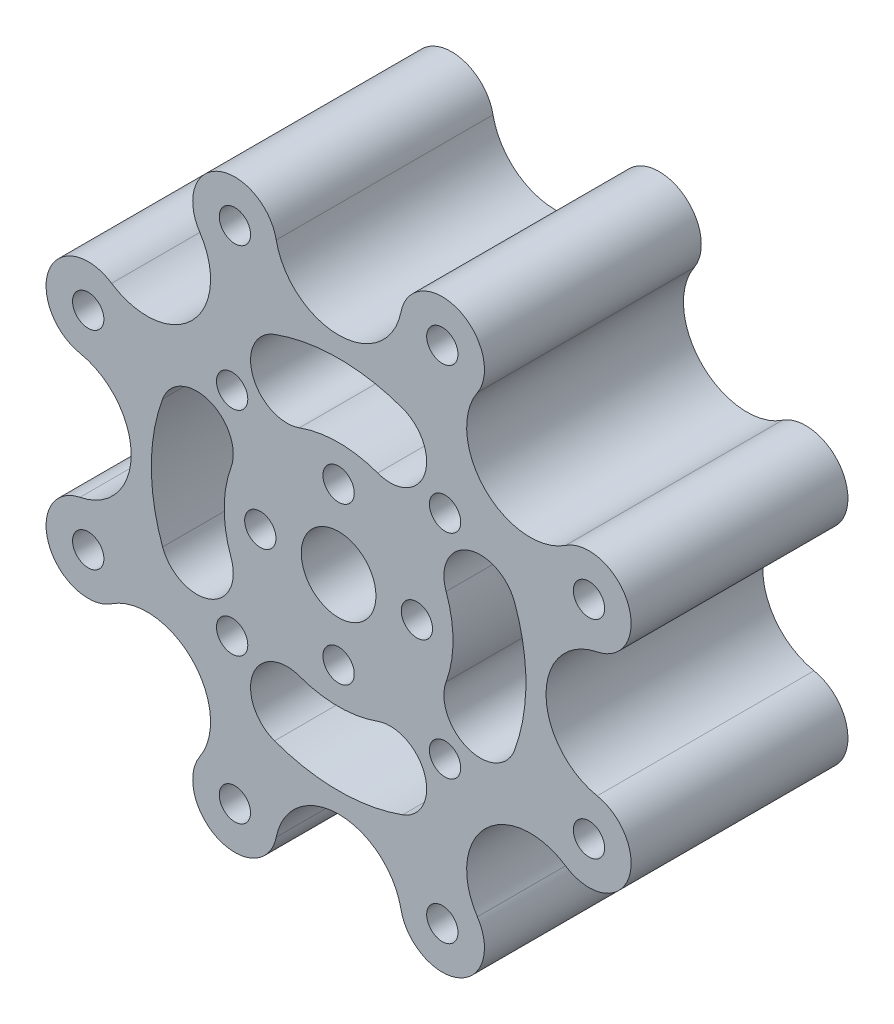
from build123d import *

# Parameters (mm, degrees)
SKETCH_1_R          = 1.3
SKETCH_1_R_2        = 3.1
EXTRUDE_1_DEPTH     = 18
CUT_EXTRUDE_1_DEPTH = 39.778149269


with BuildPart() as part:
    # ｽｹｯﾁ1 → ﾎﾞｽ - 押し出し1 (new body)
    with BuildSketch(Plane.XY):
        with BuildLine():
            ThreePointArc((11.520520871, 18.842793666), (9.949769241, 24.020867845), (5.177628747, 21.470105609))
            ThreePointArc((5.177628747, 21.470105609), (0, 17.220935509), (-5.177628747, 21.470105609))
            ThreePointArc((-5.177628747, 21.470105609), (-9.949769241, 24.020867845), (-11.520520871, 18.842793666))
            ThreePointArc((-11.520520871, 18.842793666), (-12.177040277, 12.177040277), (-18.842793666, 11.520520871))
            ThreePointArc((-18.842793666, 11.520520871), (-24.020867845, 9.949769241), (-21.470105609, 5.177628747))
            ThreePointArc((-21.470105609, 5.177628747), (-17.220935509, 0), (-21.470105609, -5.177628747))
            ThreePointArc((-21.470105609, -5.177628747), (-24.020867845, -9.949769241), (-18.842793666, -11.520520871))
            ThreePointArc((-18.842793666, -11.520520871), (-12.177040277, -12.177040277), (-11.520520871, -18.842793666))
            ThreePointArc((-11.520520871, -18.842793666), (-9.949769241, -24.020867845), (-5.177628747, -21.470105609))
            ThreePointArc((-5.177628747, -21.470105609), (0, -17.220935509), (5.177628747, -21.470105609))
            ThreePointArc((5.177628747, -21.470105609), (9.949769241, -24.020867845), (11.520520871, -18.842793666))
            ThreePointArc((11.520520871, -18.842793666), (12.177040277, -12.177040277), (18.842793666, -11.520520871))
            ThreePointArc((18.842793666, -11.520520871), (24.020867845, -9.949769241), (21.470105609, -5.177628747))
            ThreePointArc((21.470105609, -5.177628747), (17.220935509, 0), (21.470105609, 5.177628747))
            ThreePointArc((21.470105609, 5.177628747), (24.020867845, 9.949769241), (18.842793666, 11.520520871))
            ThreePointArc((18.842793666, 11.520520871), (12.177040277, 12.177040277), (11.520520871, 18.842793666))
        make_face()
        with Locations((8.610377228, 20.787289482)):
            Circle(SKETCH_1_R, mode=Mode.SUBTRACT)
        with Locations((20.787289482, 8.610377228)):
            Circle(SKETCH_1_R, mode=Mode.SUBTRACT)
        with Locations((20.787289482, -8.610377228)):
            Circle(SKETCH_1_R, mode=Mode.SUBTRACT)
        with Locations((8.610377228, -20.787289482)):
            Circle(SKETCH_1_R, mode=Mode.SUBTRACT)
        with Locations((-8.610377228, -20.787289482)):
            Circle(SKETCH_1_R, mode=Mode.SUBTRACT)
        with Locations((-20.787289482, -8.610377228)):
            Circle(SKETCH_1_R, mode=Mode.SUBTRACT)
        with Locations((-20.787289482, 8.610377228)):
            Circle(SKETCH_1_R, mode=Mode.SUBTRACT)
        with Locations((-8.610377228, 20.787289482)):
            Circle(SKETCH_1_R, mode=Mode.SUBTRACT)
        with Locations((8.838834765, 8.838834765)):
            Circle(SKETCH_1_R, mode=Mode.SUBTRACT)
        with Locations((8.838834765, -8.838834765)):
            Circle(SKETCH_1_R, mode=Mode.SUBTRACT)
        with Locations((-8.838834765, -8.838834765)):
            Circle(SKETCH_1_R, mode=Mode.SUBTRACT)
        with Locations((-8.838834765, 8.838834765)):
            Circle(SKETCH_1_R, mode=Mode.SUBTRACT)
        with Locations((0, 6.5)):
            Circle(SKETCH_1_R, mode=Mode.SUBTRACT)
        with Locations((6.5, 0)):
            Circle(SKETCH_1_R, mode=Mode.SUBTRACT)
        with Locations((0, -6.5)):
            Circle(SKETCH_1_R, mode=Mode.SUBTRACT)
        with Locations((-6.5, 0)):
            Circle(SKETCH_1_R, mode=Mode.SUBTRACT)
        Circle(SKETCH_1_R_2, mode=Mode.SUBTRACT)
    extrude(amount=EXTRUDE_1_DEPTH)

    # ｽｹｯﾁ2 → ｶｯﾄ - 押し出し1 (cut, through all)
    with BuildSketch(Plane.XY.offset(18)):
        with BuildLine():
            ThreePointArc((3.249191362, 8.927079897), (0, 9.5), (-3.249191362, 8.927079897))
            ThreePointArc((-3.249191362, 8.927079897), (-7.126372473, 10.735039142), (-5.318413229, 14.612220253))
            ThreePointArc((-5.318413229, 14.612220253), (0, 15.55), (5.318413229, 14.612220253))
            ThreePointArc((5.318413229, 14.612220253), (7.126372473, 10.735039142), (3.249191362, 8.927079897))
        make_face()
        with BuildLine():
            ThreePointArc((8.927079897, 3.249191362), (10.735039142, 7.126372473), (14.612220253, 5.318413229))
            ThreePointArc((14.612220253, 5.318413229), (15.55, 0), (14.612220253, -5.318413229))
            ThreePointArc((14.612220253, -5.318413229), (10.735039142, -7.126372473), (8.927079897, -3.249191362))
            ThreePointArc((8.927079897, -3.249191362), (9.5, 0), (8.927079897, 3.249191362))
        make_face()
        with BuildLine():
            ThreePointArc((3.249191362, -8.927079897), (7.126372473, -10.735039142), (5.318413229, -14.612220253))
            ThreePointArc((5.318413229, -14.612220253), (0, -15.55), (-5.318413229, -14.612220253))
            ThreePointArc((-5.318413229, -14.612220253), (-7.126372473, -10.735039142), (-3.249191362, -8.927079897))
            ThreePointArc((-3.249191362, -8.927079897), (0, -9.5), (3.249191362, -8.927079897))
        make_face()
        with BuildLine():
            ThreePointArc((-8.927079897, -3.249191362), (-10.735039142, -7.126372473), (-14.612220253, -5.318413229))
            ThreePointArc((-14.612220253, -5.318413229), (-15.55, 0), (-14.612220253, 5.318413229))
            ThreePointArc((-14.612220253, 5.318413229), (-10.735039142, 7.126372473), (-8.927079897, 3.249191362))
            ThreePointArc((-8.927079897, 3.249191362), (-9.5, 0), (-8.927079897, -3.249191362))
        make_face()
    extrude(amount=-CUT_EXTRUDE_1_DEPTH, mode=Mode.SUBTRACT)


solid = part.part
